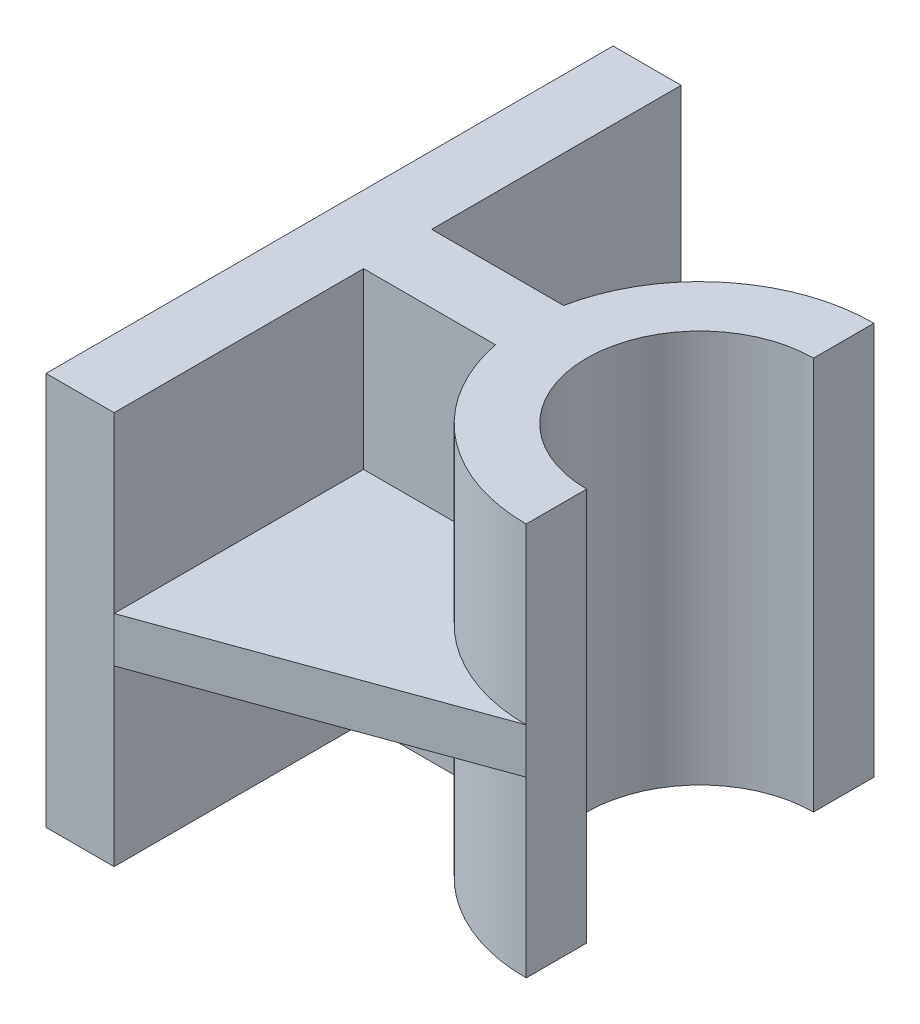
from build123d import *

# Parameters (mm, degrees)
SKETCH1_W           = 9
SKETCH1_H           = 75
BOSS_EXTRUDE1_DEPTH = 26
RIB3_REACH          = 65.738
SKETCH3_WALL_W      = 172.022520638
SKETCH3_WALL_H      = 6


with BuildPart() as part:
    # Sketch1 → Boss-Extrude1 (new, symmetric)
    with BuildSketch(Plane(origin=(0, 0, 0), x_dir=(1, 0, 0), z_dir=(0, 1, 0))):
        Rectangle(SKETCH1_W, SKETCH1_H)
        with BuildLine():
            Line((4.5, 4.5), (4.5, -4.5))
            Line((4.5, -4.5), (21.944512863, -4.5))
            ThreePointArc((21.944512863, -4.5), (21.5, 0), (21.944512863, 4.5))
            Line((21.944512863, 4.5), (4.5, 4.5))
        make_face()
        with BuildLine():
            Line((44.5, -15), (44.5, -23))
            ThreePointArc((44.5, -23), (21.5, 0), (44.5, 23))
            Line((44.5, 23), (44.5, 15))
            ThreePointArc((44.5, 15), (29.5, 0), (44.5, -15))
        make_face()
    extrude(amount=BOSS_EXTRUDE1_DEPTH, both=True)

    # Sketch3 wall → Rib3 (add, up to next)
    with BuildSketch(Plane(origin=(24.5, 0, 30.25), x_dir=(-0.940136065162, 0, 0.340799323621), z_dir=(0.340799323621, 0, 0.940136065162)), mode=Mode.PRIVATE) as rib3_sk1:
        Rectangle(SKETCH3_WALL_W, SKETCH3_WALL_H)
    rib3_tool1 = extrude(rib3_sk1.sketch, amount=-RIB3_REACH, mode=Mode.PRIVATE) - part.part
    add(rib3_tool1.solids().sort_by_distance((24.5, 0, 30.25))[0])


solid = part.part
